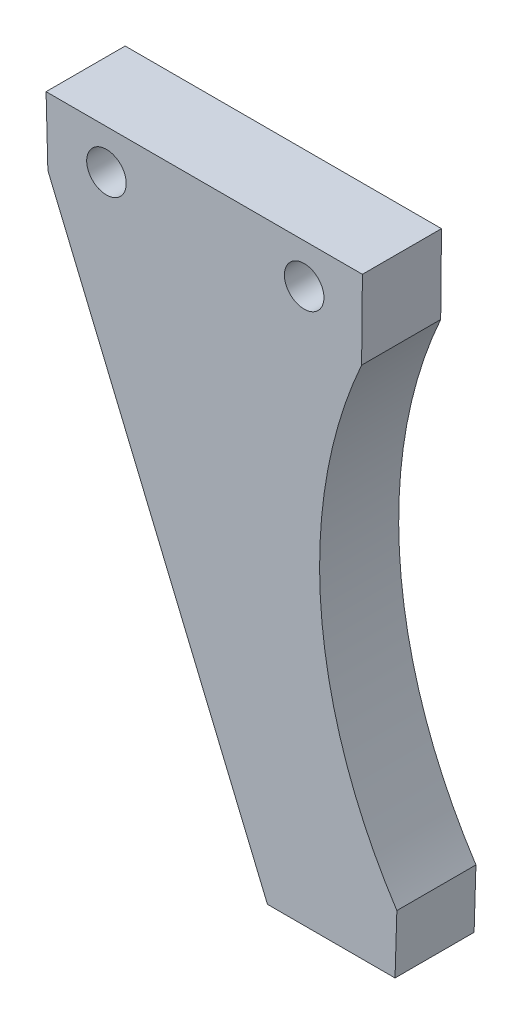
from build123d import *

# Parameters (mm, degrees)
SKETCH_1_R      = 5
EXTRUDE_2_DEPTH = 20


with BuildPart() as part:
    # 草图1 → 凸台-拉伸2 (new body)
    with BuildSketch(Plane.XY):
        with BuildLine():
            Line((-60.096041157, 27.694579337), (19.903958843, 27.694579337))
            Line((19.903958843, 27.694579337), (19.706305342, 7.694579337))
            ThreePointArc((19.706305342, 7.694579337), (9.438814214, -50.946356522), (28.617881493, -107.305420663))
            Line((28.617881493, -107.305420663), (28.156933165, -122.305420663))
            Line((28.156933165, -122.305420663), (-4.109449827, -122.305420663))
            Line((-4.109449827, -122.305420663), (-59.643539941, 10.672910248))
            Line((-59.643539941, 10.672910248), (-60.096041157, 27.694579337))
        make_face()
        with Locations((-44.824903507, 17.694579337)):
            Circle(SKETCH_1_R, mode=Mode.SUBTRACT)
        with Locations((5.175096493, 17.694579337)):
            Circle(SKETCH_1_R, mode=Mode.SUBTRACT)
    extrude(amount=EXTRUDE_2_DEPTH)


solid = part.part
